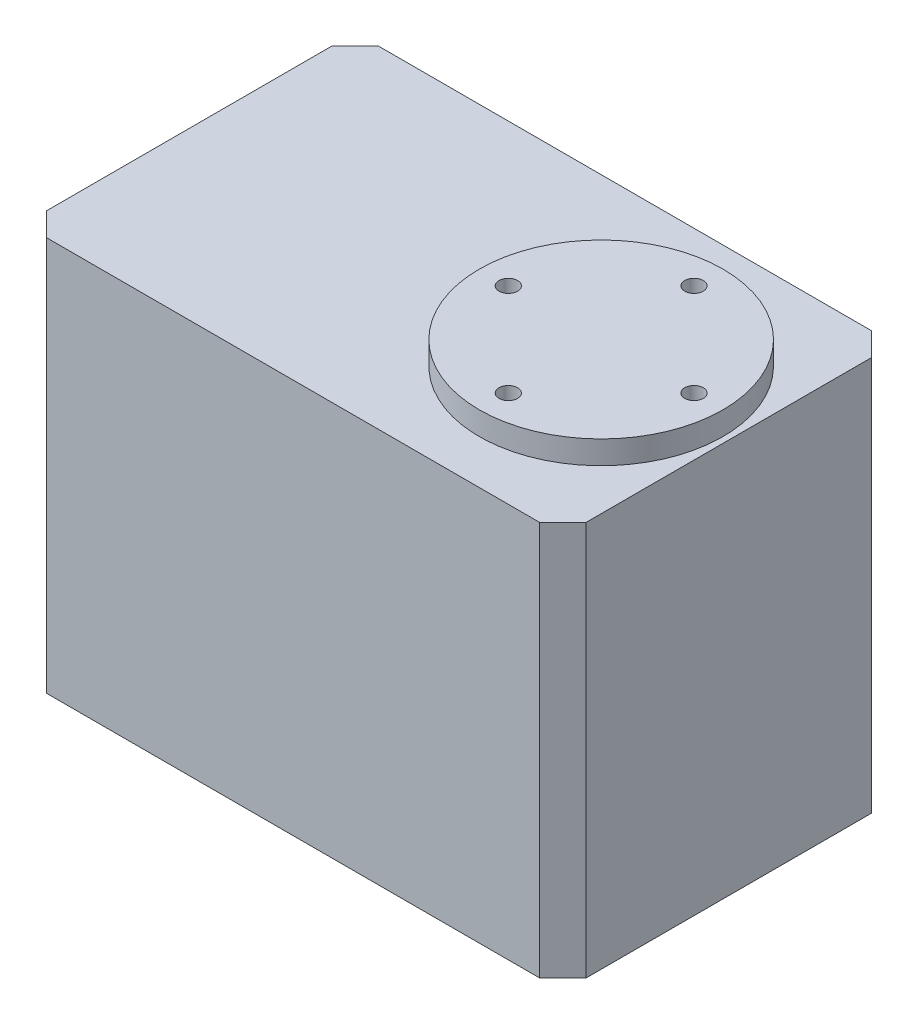
from build123d import *

# Parameters (mm, degrees)
ESQUISSE1_W               = 46.5
ESQUISSE1_H               = 28.6
BOSS_EXTRU_1_DEPTH        = 34
CHANFREIN1_SIZE           = 2
ESQUISSE2_R               = 10.5
BOSS_EXTRU_2_DEPTH        = 2
TROU_TARAUD_M2X0_41_D     = 1.6
TROU_TARAUD_M2X0_41_DEPTH = 3.2
TROU_TARAUD_M2X0_41_TIP   = 0.480688495


with BuildPart() as part:
    # Esquisse1 → Boss.-Extru.1 (new body)
    with BuildSketch(Plane(origin=(0, 0, 0), x_dir=(1, 0, 0), z_dir=(0, 1, 0))):
        Rectangle(ESQUISSE1_W, ESQUISSE1_H)
    extrude(amount=BOSS_EXTRU_1_DEPTH)

    # Chanfrein1
    chanfrein1_edges = [part.edges().sort_by_distance(p)[0] for p in [
        (23.25, 17, 14.3),
        (-23.25, 17, 14.3),
        (-23.25, 17, -14.3),
        (23.25, 17, -14.3),
    ]]
    chamfer(chanfrein1_edges, length=CHANFREIN1_SIZE)

    # Esquisse2 → Boss.-Extru.2 (add)
    with BuildSketch(Plane(origin=(0, 34, 0), x_dir=(1, 0, 0), z_dir=(0, 1, 0))):
        with Locations(Location((12.25, 0, 0), (0, 0, 90))):
            Circle(ESQUISSE2_R)
    extrude(amount=BOSS_EXTRU_2_DEPTH)

    # Trou taraudé M2x0.41
    with Locations(Plane(origin=(0, 36, 0), x_dir=(1, 0, 0), z_dir=(0, 1, 0))):
        with Locations((12.25, 8), (20.25, 0), (12.25, -8), (4.25, 0)):
            Hole(TROU_TARAUD_M2X0_41_D / 2, depth=TROU_TARAUD_M2X0_41_DEPTH)
            with Locations((0, 0, -(TROU_TARAUD_M2X0_41_DEPTH + TROU_TARAUD_M2X0_41_TIP / 2))):  # 118° drill point
                Cone(0, TROU_TARAUD_M2X0_41_D / 2, TROU_TARAUD_M2X0_41_TIP, mode=Mode.SUBTRACT)


solid = part.part
